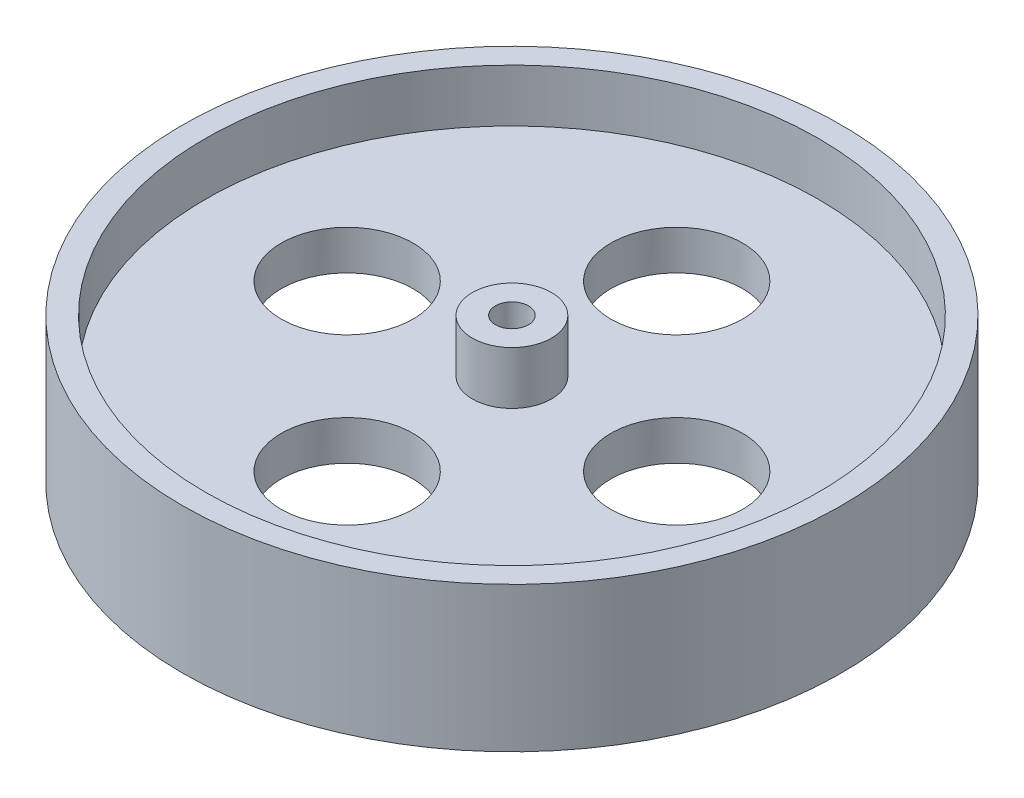
from build123d import *
from build123d.topology import SkipClean

# Parameters (mm, degrees)
ESQUISSE1_R             = 50
BOSS_EXTRU_1_DEPTH      = 22
ESQUISSE2_R             = 2.5
ENL_V_MAT_EXTRU_1_DEPTH = 7
ENL_V_START             = -15
ENL_V_MAT_EXTRU_3_DEPTH = 15
ESQUISSE4_R             = 46.5
ESQUISSE4_R_2           = 6
ENL_V_MAT_EXTRU_4_DEPTH = 8
ENL_V_START_2           = -8
ESQUISSE5_R             = 46.5
ESQUISSE5_R_2           = 6
ENL_V_MAT_EXTRU_5_DEPTH = 8
ESQUISSE6_R             = 10
ENL_V_MAT_EXTRU_6_DEPTH = 8
ESQUISSE7_R             = 10
ENL_V_MAT_EXTRU_7_DEPTH = 8
ESQUISSE8_R             = 10
ENL_V_MAT_EXTRU_8_DEPTH = 8
ESQUISSE9_R             = 10
ENL_V_MAT_EXTRU_9_DEPTH = 8


with BuildPart() as part:
    # Esquisse1 → Boss.-Extru.1 (new body)
    with BuildSketch(Plane(origin=(0, 0, 0), x_dir=(1, 0, 0), z_dir=(0, 1, 0))):
        with Locations(Location((0, 0, 0), (0, 0, 270))):
            Circle(ESQUISSE1_R)
    extrude(amount=BOSS_EXTRU_1_DEPTH)

    # Esquisse2 → Enlèv. mat.-Extru.1 (cut)
    with BuildSketch(Plane(origin=(0, 22, 0), x_dir=(1, 0, 0), z_dir=(0, 1, 0))):
        with Locations(Location((0, 0, 0), (0, 0, 270))):
            Circle(ESQUISSE2_R)
    extrude(amount=-ENL_V_MAT_EXTRU_1_DEPTH, mode=Mode.SUBTRACT)

    # Esquisse3 → Enlèv. mat.-Extru.3 (cut)
    with SkipClean():  # the faces are left unmerged after this step: merging them gives an invalid solid
        with BuildSketch(Plane(origin=(0, 0, 0), x_dir=(-1, 0, 0), z_dir=(0, -1, 0)).offset(ENL_V_START)):
            with BuildLine():
                ThreePointArc((2.415699998, 0.643734045), (-2.479075587, 0.322775824), (2.170328924, -1.240835348))
                Line((2.170328924, -1.240835348), (2.415699998, 0.643734045))
            make_face()
        extrude(amount=ENL_V_MAT_EXTRU_3_DEPTH, mode=Mode.SUBTRACT)

    # Esquisse4 → Enlèv. mat.-Extru.4 (cut)
    with SkipClean():  # the faces are left unmerged after this step: merging them gives an invalid solid
        with BuildSketch(Plane(origin=(0, 22, 0), x_dir=(1, 0, 0), z_dir=(0, 1, 0))):
            with Locations(Location((0, 0, 0), (0, 0, 270))):
                Circle(ESQUISSE4_R)
            with Locations(Location((0, 0, 0), (0, 0, 270))):
                Circle(ESQUISSE4_R_2, mode=Mode.SUBTRACT)
        extrude(amount=-ENL_V_MAT_EXTRU_4_DEPTH, mode=Mode.SUBTRACT)

    # Esquisse5 → Enlèv. mat.-Extru.5 (cut)
    with SkipClean():  # the faces are left unmerged after this step: merging them gives an invalid solid
        with BuildSketch(Plane(origin=(0, 0, 0), x_dir=(-1, 0, 0), z_dir=(0, -1, 0)).offset(ENL_V_START_2)):
            with Locations(Location((0, 0, 0), (0, 0, 270))):
                Circle(ESQUISSE5_R)
            with Locations(Location((0, 0, 0), (0, 0, 270))):
                Circle(ESQUISSE5_R_2, mode=Mode.SUBTRACT)
        extrude(amount=ENL_V_MAT_EXTRU_5_DEPTH, mode=Mode.SUBTRACT)

    # Esquisse6 → Enlèv. mat.-Extru.6 (cut)
    with SkipClean():  # the faces are left unmerged after this step: merging them gives an invalid solid
        with BuildSketch(Plane(origin=(0, 14, 0), x_dir=(1, 0, 0), z_dir=(0, 1, 0))):
            with Locations(Location((0, 25, 0), (0, 0, 270))):
                Circle(ESQUISSE6_R)
        extrude(amount=-ENL_V_MAT_EXTRU_6_DEPTH, mode=Mode.SUBTRACT)

    # Esquisse7 → Enlèv. mat.-Extru.7 (cut)
    with SkipClean():  # the faces are left unmerged after this step: merging them gives an invalid solid
        with BuildSketch(Plane(origin=(0, 14, 0), x_dir=(1, 0, 0), z_dir=(0, 1, 0))):
            with Locations(Location((25, 0, 0), (0, 0, 270))):
                Circle(ESQUISSE7_R)
        extrude(amount=-ENL_V_MAT_EXTRU_7_DEPTH, mode=Mode.SUBTRACT)

    # Esquisse8 → Enlèv. mat.-Extru.8 (cut)
    with SkipClean():  # the faces are left unmerged after this step: merging them gives an invalid solid
        with BuildSketch(Plane(origin=(0, 14, 0), x_dir=(1, 0, 0), z_dir=(0, 1, 0))):
            with Locations(Location((0, -25, 0), (0, 0, 270))):
                Circle(ESQUISSE8_R)
        extrude(amount=-ENL_V_MAT_EXTRU_8_DEPTH, mode=Mode.SUBTRACT)

    # Esquisse9 → Enlèv. mat.-Extru.9 (cut)
    with SkipClean():  # the faces are left unmerged after this step: merging them gives an invalid solid
        with BuildSketch(Plane(origin=(0, 14, 0), x_dir=(1, 0, 0), z_dir=(0, 1, 0))):
            with Locations(Location((-25, 0, 0), (0, 0, 270))):
                Circle(ESQUISSE9_R)
        extrude(amount=-ENL_V_MAT_EXTRU_9_DEPTH, mode=Mode.SUBTRACT)


solid = part.part
